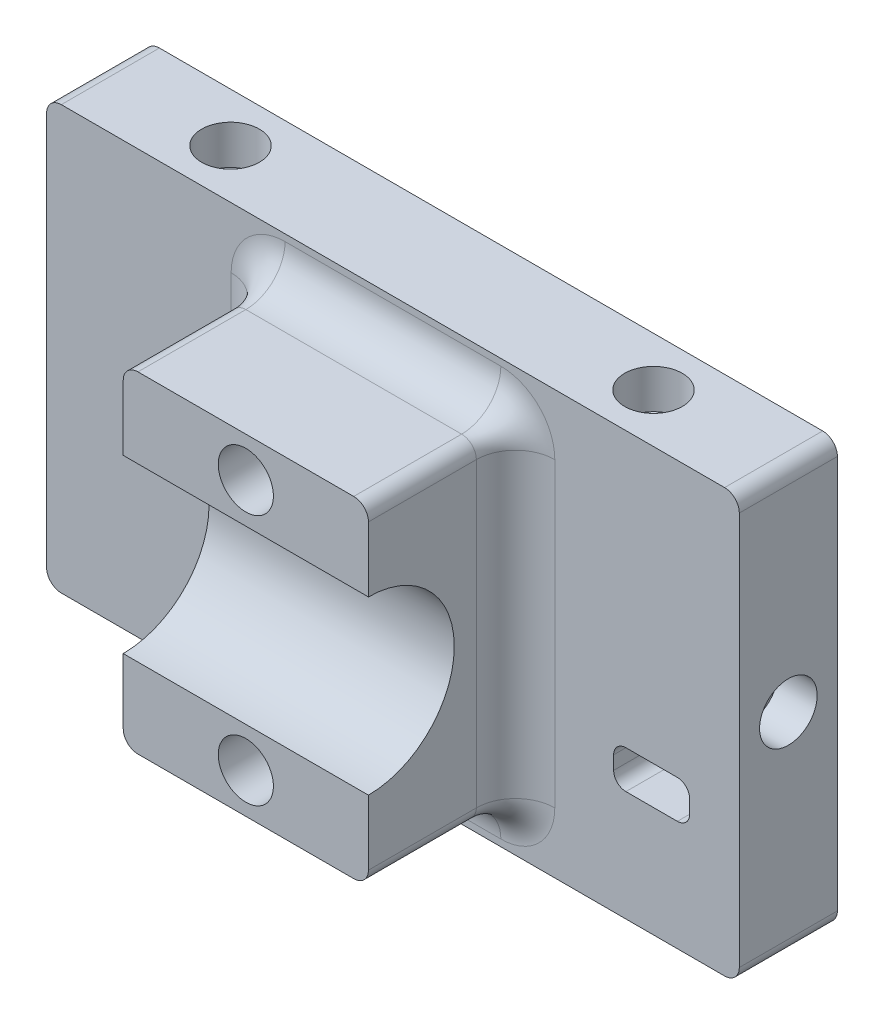
from build123d import *

# Parameters (mm, degrees)
ESQUISSE1_W                = 56.5
ESQUISSE1_H                = 34.5
BASE_DEPTH                 = 8
ESQUISSE2_R                = 2.35
INSERT_M3_L_DEPTH          = 3.2
INSERT_M3_R_START          = -3.2
ESQUISSE3_R                = 2.35
INSERT_M3_R_DEPTH          = 3.2
ESQUISSE4_R                = 2.35
INSERT_M3_TOP_DEPTH        = 3.2
INSER_M3_BOT_START         = 3.2
ESQUISSE5_R                = 2.35
INSER_M3_BOT_DEPTH         = 3.2
ESQUISSE11_R               = 1.5
PASSAGE_VIS_L_DEPTH        = 5
PASSAGE_VIS_R_START        = -5
ESQUISSE12_R               = 1.5
PASSAGE_VIS_R_DEPTH        = 5
ESQUISSE10_R               = 1.5
PASSAGE_VIS_TOP_DEPTH      = 5
PASSAGE_VIS_BOT_START      = -5
ESQUISSE13_R               = 1.5
PASSAGE_VIS_BOT_DEPTH      = 5
CONG_1_R                   = 1.2
ESQUISSE6_W                = 20
ESQUISSE6_H                = 27
SUPPORT_FIXATION_DEPTH     = 12
PASSAGE_GUIDON_REACH       = 48.483
CONG_VERTICAL_R            = 1.2
CONG_BASE_R                = 3.2
ESQUISSE8_R                = 2.25
INSERTS_M3_FIXATION_DEPTH  = 3.2
ESQUISSE9_R                = 1.5
PASSAGE_VIS_FIXATION_DEPTH = 5
PASSE_CABLE_DEPTH          = 8


with BuildPart() as part:
    # Esquisse1 → Base (new body)
    with BuildSketch(Plane.XY):
        Rectangle(ESQUISSE1_W, ESQUISSE1_H)
    extrude(amount=BASE_DEPTH)

    # Esquisse2 → Insert_M3_L (cut)
    with BuildSketch(Plane.ZY.offset(28.25)):
        with Locations(Location((4, 0, 0), (0, 0, 270))):
            Circle(ESQUISSE2_R)
    extrude(amount=-INSERT_M3_L_DEPTH, mode=Mode.SUBTRACT)

    # Esquisse3 → Insert_M3_R (cut)
    with BuildSketch(Plane(origin=(28.25, 0, 0), x_dir=(0, 0, -1), z_dir=(1, 0, 0)).offset(INSERT_M3_R_START)):
        with Locations(Location((-4, 0, 0), (0, 0, 270))):
            Circle(ESQUISSE3_R)
    extrude(amount=INSERT_M3_R_DEPTH, mode=Mode.SUBTRACT)

    # Esquisse4 → Insert_M3_TOP (cut)
    with BuildSketch(Plane(origin=(0, 17.25, 0), x_dir=(1, 0, 0), z_dir=(0, 1, 0))):
        with Locations(Location((-17.25, -4, 0), (0, 0, 180))):
            Circle(ESQUISSE4_R)
        with Locations(Location((17.25, -4, 0), (0, 0, 180))):
            Circle(ESQUISSE4_R)
    extrude(amount=-INSERT_M3_TOP_DEPTH, mode=Mode.SUBTRACT)

    # Esquisse5 → Inser_M3_BOT (cut)
    with BuildSketch(Plane(origin=(0, -17.25, -17), x_dir=(1, 0, 0), z_dir=(0, 1, 0)).offset(INSER_M3_BOT_START)):
        with Locations(Location((-17.25, -21, 0), (0, 0, 180))):
            Circle(ESQUISSE5_R)
        with Locations(Location((17.25, -21, 0), (0, 0, 180))):
            Circle(ESQUISSE5_R)
    extrude(amount=-INSER_M3_BOT_DEPTH, mode=Mode.SUBTRACT)

    # Esquisse11 → Passage_Vis_L (cut)
    with BuildSketch(Plane.ZY.offset(25.05)):
        with Locations(Location((4, 0, 0), (0, 0, 270))):
            Circle(ESQUISSE11_R)
    extrude(amount=-PASSAGE_VIS_L_DEPTH, mode=Mode.SUBTRACT)

    # Esquisse12 → Passage_Vis_R (cut)
    with BuildSketch(Plane(origin=(25.05, 0, 0), x_dir=(0, 0, -1), z_dir=(1, 0, 0)).offset(PASSAGE_VIS_R_START)):
        with Locations(Location((-4, 0, 0), (0, 0, 270))):
            Circle(ESQUISSE12_R)
    extrude(amount=PASSAGE_VIS_R_DEPTH, mode=Mode.SUBTRACT)

    # Esquisse10 → Passage_Vis_TOP (cut)
    with BuildSketch(Plane(origin=(0, 14.05, 0), x_dir=(1, 0, 0), z_dir=(0, 1, 0))):
        with Locations(Location((-17.25, -4, 0), (0, 0, 180))):
            Circle(ESQUISSE10_R)
        with Locations(Location((17.25, -4, 0), (0, 0, 180))):
            Circle(ESQUISSE10_R)
    extrude(amount=-PASSAGE_VIS_TOP_DEPTH, mode=Mode.SUBTRACT)

    # Esquisse13 → Passage_Vis_BOT (cut)
    with BuildSketch(Plane.XZ.offset(14.05).offset(PASSAGE_VIS_BOT_START)):
        with Locations(Location((-17.25, 4, 0), (0, 0, 180))):
            Circle(ESQUISSE13_R)
        with Locations(Location((17.25, 4, 0), (0, 0, 180))):
            Circle(ESQUISSE13_R)
    extrude(amount=PASSAGE_VIS_BOT_DEPTH, mode=Mode.SUBTRACT)

    # Congé1
    cong_1_edges = [part.edges().sort_by_distance(p)[0] for p in [
        (-28.25, 17.25, 4),
        (28.25, 17.25, 4),
        (28.25, -17.25, 4),
        (-28.25, -17.25, 4),
    ]]
    fillet(cong_1_edges, radius=CONG_1_R)

    # Esquisse6 → Support_Fixation (add)
    with BuildSketch(Plane.XY.offset(8)):
        Rectangle(ESQUISSE6_W, ESQUISSE6_H)
    extrude(amount=SUPPORT_FIXATION_DEPTH)

    # Esquisse7 → Passage_Guidon (cut, up to next)
    with BuildSketch(Plane.ZY.offset(10), mode=Mode.PRIVATE) as passage_guidon_sk1:
        with BuildLine():
            Line((20, 7), (20, -7))
            ThreePointArc((20, -7), (13, 0), (20, 7))
        make_face()
    passage_guidon_tool1 = extrude(passage_guidon_sk1.sketch, amount=-PASSAGE_GUIDON_REACH, mode=Mode.PRIVATE) & part.part
    add(passage_guidon_tool1.solids().sort_by_distance((-10, 0, 17.029108))[0], mode=Mode.SUBTRACT)

    # Congé_Vertical
    cong_vertical_edges = [part.edges().sort_by_distance(p)[0] for p in [
        (-10, 13.5, 14),
        (-10, -13.5, 14),
        (10, -13.5, 14),
        (10, 13.5, 14),
    ]]
    fillet(cong_vertical_edges, radius=CONG_VERTICAL_R)

    # Congé_Base
    cong_base_edges = [part.edges().sort_by_distance(p)[0] for p in [
        (-10, 0, 8),
        (0, 13.5, 8),
        (10, 0, 8),
        (0, -13.5, 8),
        (-9.648528137, 13.148528137, 8),
        (9.648528137, 13.148528137, 8),
        (9.648528137, -13.148528137, 8),
        (-9.648528137, -13.148528137, 8),
    ]]
    fillet(cong_base_edges, radius=CONG_BASE_R)

    # Esquisse8 → Inserts_M3_Fixation (cut)
    with BuildSketch(Plane.XY.offset(20)):
        with Locations((0, 10.25)):
            Circle(ESQUISSE8_R)
        with Locations(Location((0, -10.25, 0), (0, 0, 180))):
            Circle(ESQUISSE8_R)
    extrude(amount=-INSERTS_M3_FIXATION_DEPTH, mode=Mode.SUBTRACT)

    # Esquisse9 → Passage_Vis_Fixation (cut)
    with BuildSketch(Plane.XY.offset(16.8)):
        with Locations((0, 10.25)):
            Circle(ESQUISSE9_R)
        with Locations(Location((0, -10.25, 0), (0, 0, 180))):
            Circle(ESQUISSE9_R)
    extrude(amount=-PASSAGE_VIS_FIXATION_DEPTH, mode=Mode.SUBTRACT)

    # Esquisse14 → Passe_Cable (cut)
    with BuildSketch(Plane.XY.offset(8)):
        with BuildLine():
            Line((19, -5.15), (23.2, -5.15))
            ThreePointArc((23.2, -5.15), (23.907106781, -5.442893219), (24.2, -6.15))
            Line((24.2, -6.15), (24.2, -7.25))
            ThreePointArc((24.2, -7.25), (23.907106781, -7.957106781), (23.2, -8.25))
            Line((23.2, -8.25), (19, -8.25))
            ThreePointArc((19, -8.25), (18.292893219, -7.957106781), (18, -7.25))
            Line((18, -7.25), (18, -6.15))
            ThreePointArc((18, -6.15), (18.292893219, -5.442893219), (19, -5.15))
        make_face()
    extrude(amount=-PASSE_CABLE_DEPTH, mode=Mode.SUBTRACT)


solid = part.part
